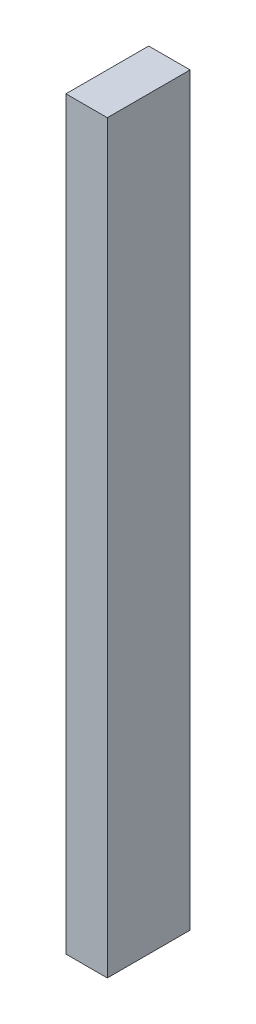
from build123d import *

# Parameters (mm, degrees)
SKETCH1_W           = 4
SKETCH1_H           = 36
BOSS_EXTRUDE1_DEPTH = 2


with BuildPart() as part:
    # Sketch1 → Boss-Extrude1 (new body)
    with BuildSketch(Plane(origin=(0, 0, 0), x_dir=(0, 0, -1), z_dir=(1, 0, 0))):
        Rectangle(SKETCH1_W, SKETCH1_H)
    extrude(amount=BOSS_EXTRUDE1_DEPTH)


solid = part.part
